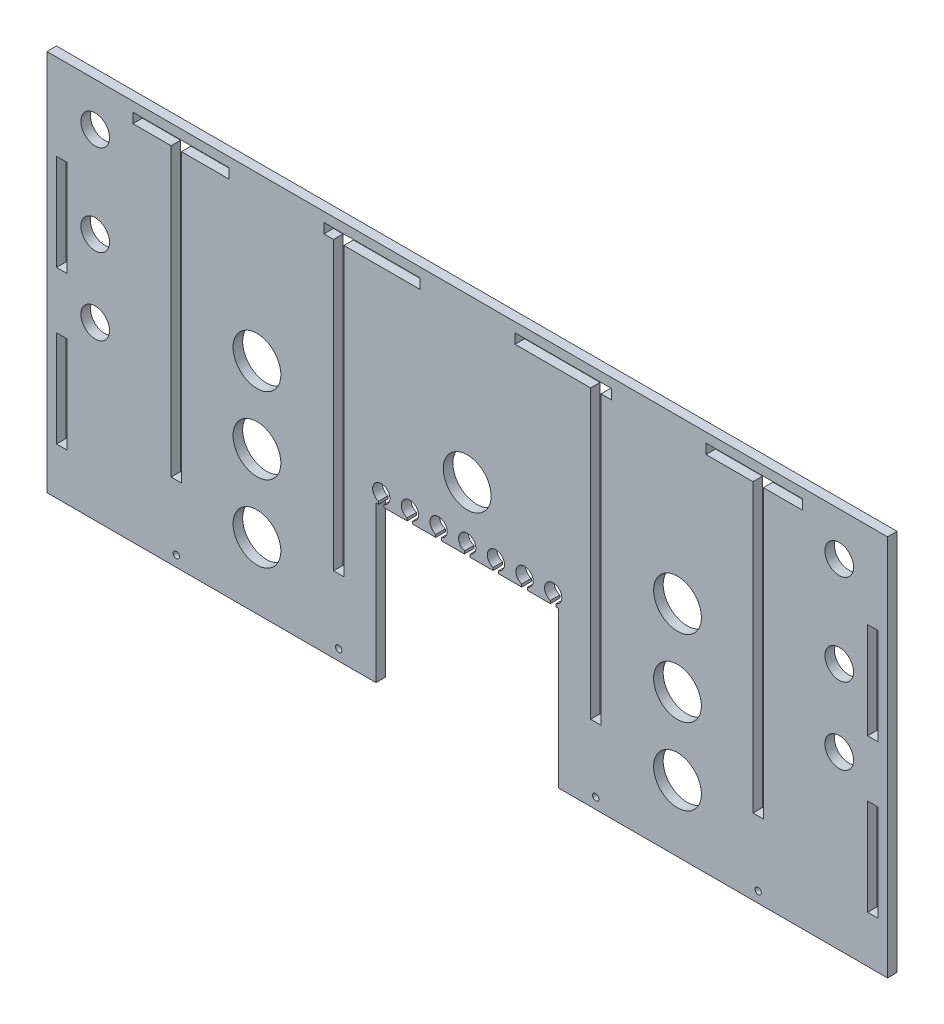
from build123d import *

# Parameters (mm, degrees)
ESQUISSE1_R        = 1.65
ESQUISSE1_R_2      = 7.5
ESQUISSE1_R_3      = 12.5
ESQUISSE1_W        = 5.4
ESQUISSE1_H        = 50.4
BOSS_EXTRU_1_DEPTH = 5


with BuildPart() as part:
    # Esquisse1 → Boss.-Extru.1 (new body)
    with BuildSketch(Plane.XY):
        with BuildLine():
            Line((-220, 100), (-0.145812859, 100))
            Line((-0.145812859, 100), (9.854187141, 100))
            Line((9.854187141, 100), (220, 100))
            Line((220, 100), (220, -100))
            Line((220, -100), (47.761564371, -100))
            Line((47.761564371, -100), (47.761564371, -18.538015518))
            Line((47.761564371, -18.538015518), (46.481557411, -18.538015518))
            Line((46.481557411, -18.538015518), (46.481557411, -17.125104692))
            ThreePointArc((46.481557411, -17.125104692), (45, -8.375988591), (43.518442589, -17.125104692))
            Line((43.518442589, -17.125104692), (43.518442589, -18.538015518))
            Line((43.518442589, -18.538015518), (31.481557411, -18.538015518))
            Line((31.481557411, -18.538015518), (31.481557411, -17.125104692))
            ThreePointArc((31.481557411, -17.125104692), (30, -8.375988591), (28.518442589, -17.125104692))
            Line((28.518442589, -17.125104692), (28.518442589, -18.538015518))
            Line((28.518442589, -18.538015518), (16.481557411, -18.538015518))
            Line((16.481557411, -18.538015518), (16.481557411, -17.125104692))
            ThreePointArc((16.481557411, -17.125104692), (15, -8.375988591), (13.518442589, -17.125104692))
            Line((13.518442589, -17.125104692), (13.518442589, -18.538015518))
            Line((13.518442589, -18.538015518), (1.481557411, -18.538015518))
            Line((1.481557411, -18.538015518), (1.481557411, -17.125104692))
            ThreePointArc((1.481557411, -17.125104692), (0, -8.375988591), (-1.481557411, -17.125104692))
            Line((-1.481557411, -17.125104692), (-1.481557411, -18.538015518))
            Line((-1.481557411, -18.538015518), (-13.518442589, -18.538015518))
            Line((-13.518442589, -18.538015518), (-13.518442589, -17.125104692))
            ThreePointArc((-13.518442589, -17.125104692), (-15, -8.375988591), (-16.481557411, -17.125104692))
            Line((-16.481557411, -17.125104692), (-16.481557411, -18.538015518))
            Line((-16.481557411, -18.538015518), (-28.518442589, -18.538015518))
            Line((-28.518442589, -18.538015518), (-28.518442589, -17.125104692))
            ThreePointArc((-28.518442589, -17.125104692), (-30, -8.375988591), (-31.481557411, -17.125104692))
            Line((-31.481557411, -17.125104692), (-31.481557411, -18.538015518))
            Line((-31.481557411, -18.538015518), (-43.518442589, -18.538015518))
            Line((-43.518442589, -18.538015518), (-43.518442589, -17.125104692))
            ThreePointArc((-43.518442589, -17.125104692), (-45, -8.375988591), (-46.481557411, -17.125104692))
            Line((-46.481557411, -17.125104692), (-46.481557411, -18.538015518))
            Line((-46.481557411, -18.538015518), (-47.761564371, -18.538015518))
            Line((-47.761564371, -18.538015518), (-47.761564371, -100))
            Line((-47.761564371, -100), (-220, -100))
            Line((-220, -100), (-220, 100))
        make_face()
        with Locations((-152.3, -94.376990981)):
            Circle(ESQUISSE1_R, mode=Mode.SUBTRACT)
        with Locations((-67.3, -94.376990981)):
            Circle(ESQUISSE1_R, mode=Mode.SUBTRACT)
        with Locations(Location((67.3, -94.376990981, 0), (0, 0, 180))):
            Circle(ESQUISSE1_R, mode=Mode.SUBTRACT)
        with Locations(Location((152.3, -94.376990981, 0), (0, 0, 180))):
            Circle(ESQUISSE1_R, mode=Mode.SUBTRACT)
        with Locations((-194.730758968, 77.3)):
            Circle(ESQUISSE1_R_2, mode=Mode.SUBTRACT)
        with Locations((-194.730758968, -10.2)):
            Circle(ESQUISSE1_R_2, mode=Mode.SUBTRACT)
        with Locations((-194.730758968, 29.8)):
            Circle(ESQUISSE1_R_2, mode=Mode.SUBTRACT)
        with Locations(Location((194.730758968, -10.2, 0), (0, 0, 180))):
            Circle(ESQUISSE1_R_2, mode=Mode.SUBTRACT)
        with Locations(Location((194.730758968, 77.3, 0), (0, 0, 180))):
            Circle(ESQUISSE1_R_2, mode=Mode.SUBTRACT)
        with Locations(Location((194.730758968, 29.8, 0), (0, 0, 180))):
            Circle(ESQUISSE1_R_2, mode=Mode.SUBTRACT)
        with Locations((110.068688128, 14.7)):
            Circle(ESQUISSE1_R_3, mode=Mode.SUBTRACT)
        with Locations((0, 14.7)):
            Circle(ESQUISSE1_R_3, mode=Mode.SUBTRACT)
        with Locations(Location((-110.068688128, 14.7, 0), (0, 0, 180))):
            Circle(ESQUISSE1_R_3, mode=Mode.SUBTRACT)
        with Locations((110.068688128, -25.3)):
            Circle(ESQUISSE1_R_3, mode=Mode.SUBTRACT)
        with Locations(Location((-110.068688128, -25.3, 0), (0, 0, 180))):
            Circle(ESQUISSE1_R_3, mode=Mode.SUBTRACT)
        with Locations((110.068688128, -65.3)):
            Circle(ESQUISSE1_R_3, mode=Mode.SUBTRACT)
        with Locations(Location((-110.068688128, -65.3, 0), (0, 0, 180))):
            Circle(ESQUISSE1_R_3, mode=Mode.SUBTRACT)
        Polygon((-70, 89.8), (-70, -60.4), (-64.6, -60.4), (-64.6, 89.8), (-24.6, 89.8), (-24.6, 95), (-75, 95), (-75, 89.8), align=None, mode=Mode.SUBTRACT)
        Polygon((-155, 89.8), (-155, -60.4), (-149.6, -60.4), (-149.6, 89.8), (-124.6, 89.8), (-124.6, 95), (-175, 95), (-175, 89.8), align=None, mode=Mode.SUBTRACT)
        Polygon((155, -60.4), (149.6, -60.4), (149.6, 89.8), (125, 89.8), (125, 95), (175.4, 95), (175.4, 89.8), (155, 89.8), align=None, mode=Mode.SUBTRACT)
        Polygon((64.6, 89.8), (64.6, -60.4), (70, -60.4), (70, 89.8), (75.4, 89.8), (75.4, 95), (25, 95), (25, 89.8), align=None, mode=Mode.SUBTRACT)
        with Locations((212.3, -50.2)):
            Rectangle(ESQUISSE1_W, ESQUISSE1_H, mode=Mode.SUBTRACT)
        with Locations((212.3, 29.8)):
            Rectangle(ESQUISSE1_W, ESQUISSE1_H, mode=Mode.SUBTRACT)
        with Locations((-212.3, -50.2)):
            Rectangle(ESQUISSE1_W, ESQUISSE1_H, mode=Mode.SUBTRACT)
        with Locations((-212.3, 29.8)):
            Rectangle(ESQUISSE1_W, ESQUISSE1_H, mode=Mode.SUBTRACT)
    extrude(amount=BOSS_EXTRU_1_DEPTH)


solid = part.part
